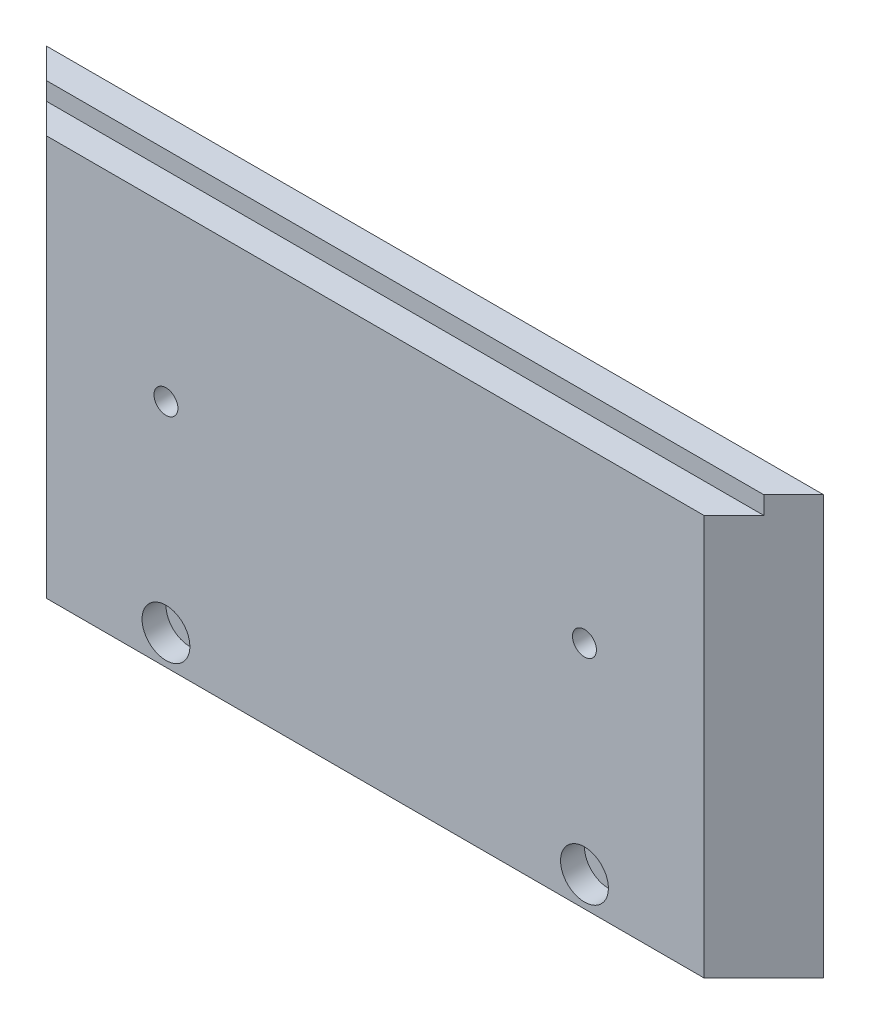
from build123d import *

# Parameters (mm, degrees)
BOSS_EXTRUDE1_DEPTH     = 70
CUT_EXTRUDE1_DEPTH      = 148.986485869
CUT_EXTRUDE1_DEPTH_BACK = 3
SKETCH3_R               = 4
CUT_EXTRUDE2_DEPTH      = 4
SKETCH4_R               = 2
CUT_EXTRUDE3_DEPTH      = 4


with BuildPart() as part:
    # Sketch1 → Boss-Extrude1 (new body)
    with BuildSketch(Plane(origin=(0, 0, 0), x_dir=(1, 0, 0), z_dir=(0, 1, 0))):
        Polygon((130, 10), (0, 10), (10, 0), (120, 0), align=None)
    extrude(amount=BOSS_EXTRUDE1_DEPTH)

    # Sketch2 → Cut-Extrude1 (cut, two sides: drawn at the far end of the back side and taken through both)
    with BuildSketch(Plane(origin=(0, 70, 0), x_dir=(1, 0, 0), z_dir=(0, 1, 0)).offset(-CUT_EXTRUDE1_DEPTH_BACK)):
        Polygon((125, 5), (5, 5), (10, 0), (120, 0), align=None)
    extrude(amount=CUT_EXTRUDE1_DEPTH + CUT_EXTRUDE1_DEPTH_BACK, mode=Mode.SUBTRACT)

    # Sketch3 → Cut-Extrude2 (cut)
    with BuildSketch(Plane.XY):
        with Locations((30, 5)):
            Circle(SKETCH3_R)
        with Locations((100, 5)):
            Circle(SKETCH3_R)
    extrude(amount=-CUT_EXTRUDE2_DEPTH, mode=Mode.SUBTRACT)

    # Sketch4 → Cut-Extrude3 (cut)
    with BuildSketch(Plane.XY):
        with Locations((30, 38.5)):
            Circle(SKETCH4_R)
        with Locations((100, 38.5)):
            Circle(SKETCH4_R)
    extrude(amount=-CUT_EXTRUDE3_DEPTH, mode=Mode.SUBTRACT)


solid = part.part
